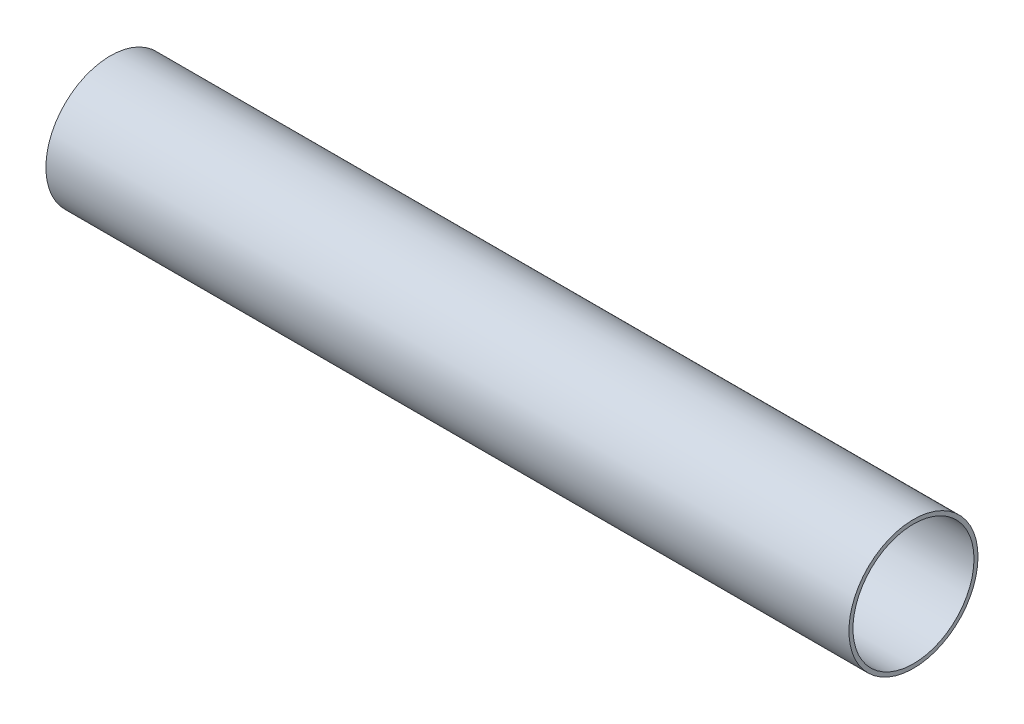
from build123d import *

# Parameters (mm, degrees)
SKETCH1_R           = 14.2875
SKETCH1_R_2         = 13.3985
BOSS_EXTRUDE1_DEPTH = 88.9


with BuildPart() as part:
    # Sketch1 → Boss-Extrude1 (new, symmetric)
    with BuildSketch(Plane(origin=(0, 0, 0), x_dir=(0, 0, -1), z_dir=(1, 0, 0))):
        Circle(SKETCH1_R)
        Circle(SKETCH1_R_2, mode=Mode.SUBTRACT)
    extrude(amount=BOSS_EXTRUDE1_DEPTH, both=True)


solid = part.part
